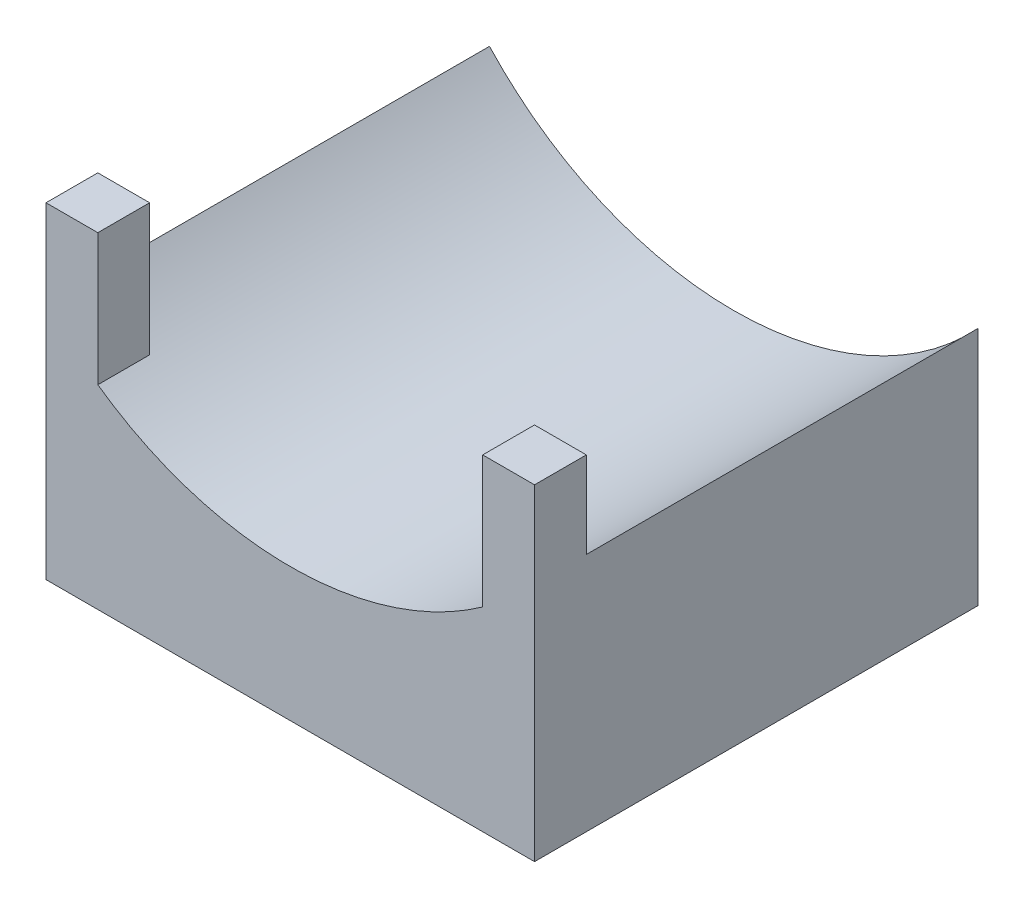
from build123d import *

# Parameters (mm, degrees)
BOSS_EXTRUDE1_DEPTH = 12
SKETCH3_W           = 1.5875
SKETCH3_H           = 10
BOSS_EXTRUDE2_DEPTH = 1.5875
BOSS_EXTRUDE3_DEPTH = 1.5875


with BuildPart() as part:
    # Sketch2 → Boss-Extrude1 (new body)
    with BuildSketch(Plane.XY):
        with BuildLine():
            ThreePointArc((-7.4837, -6.930673438), (0, -10.2), (7.4837, -6.930673438))
            Line((7.4837, -6.930673438), (7.4837, -14.2875))
            Line((7.4837, -14.2875), (-7.4837, -14.2875))
            Line((-7.4837, -14.2875), (-7.4837, -6.930673438))
        make_face()
    extrude(amount=BOSS_EXTRUDE1_DEPTH)

    # Sketch3 → Boss-Extrude2 (add)
    with BuildSketch(Plane.XY.offset(12)):
        with Locations((-6.68995, -9.2875)):
            Rectangle(SKETCH3_W, SKETCH3_H)
        with Locations((6.68995, -9.2875)):
            Rectangle(SKETCH3_W, SKETCH3_H)
    extrude(amount=BOSS_EXTRUDE2_DEPTH)

    # Sketch4 → Boss-Extrude3 (add)
    with BuildSketch(Plane.XY.offset(12)):
        with BuildLine():
            Line((-5.8962, -8.323149978), (-5.8962, -14.2875))
            Line((-5.8962, -14.2875), (5.8962, -14.2875))
            Line((5.8962, -14.2875), (5.8962, -8.323149978))
            ThreePointArc((5.8962, -8.323149978), (0, -10.2), (-5.8962, -8.323149978))
        make_face()
    extrude(amount=BOSS_EXTRUDE3_DEPTH)


solid = part.part
